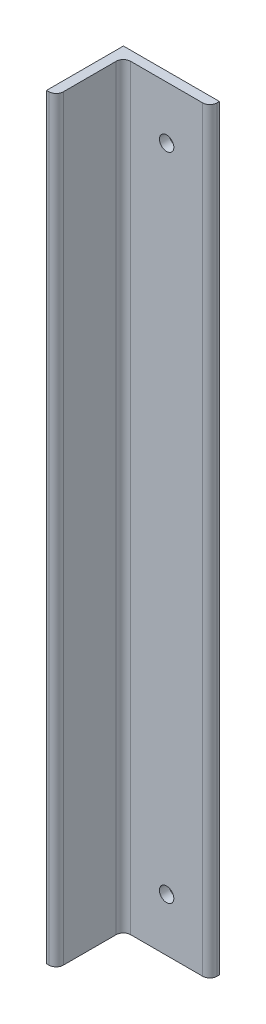
from build123d import *

# Parameters (mm, degrees)
NGULO_L_L2_5X2X0_25_1_DEPTH = 500
CROQUIS3_R                  = 4.7625
CORTAR_EXTRUIR1_DEPTH       = 6.35


with BuildPart() as part:
    # Sketch1 → Ángulo l L2.5X2X0.25(1) (new body)
    with BuildSketch(Plane.ZX):
        with BuildLine():
            Line((0, 0), (0, 63.5))
            Line((0, 63.5), (1.59258, 63.5))
            ThreePointArc((1.59258, 63.5), (4.956583943, 62.106583943), (6.35, 58.74258))
            Line((6.35, 58.74258), (6.35, 11.1125))
            ThreePointArc((6.35, 11.1125), (7.744903955, 7.744903955), (11.1125, 6.35))
            Line((11.1125, 6.35), (46.04258, 6.35))
            ThreePointArc((46.04258, 6.35), (49.406583943, 4.956583943), (50.8, 1.59258))
            Line((50.8, 1.59258), (50.8, 0))
            Line((50.8, 0), (0, 0))
        make_face()
    extrude(amount=NGULO_L_L2_5X2X0_25_1_DEPTH)

    # Croquis3 → Cortar-Extruir1 (cut)
    with BuildSketch(Plane.XY.offset(6.35)):
        with Locations((34.92754, 465)):
            Circle(CROQUIS3_R)
        with Locations((34.92754, 35)):
            Circle(CROQUIS3_R)
    extrude(amount=-CORTAR_EXTRUIR1_DEPTH, mode=Mode.SUBTRACT)


solid = part.part
